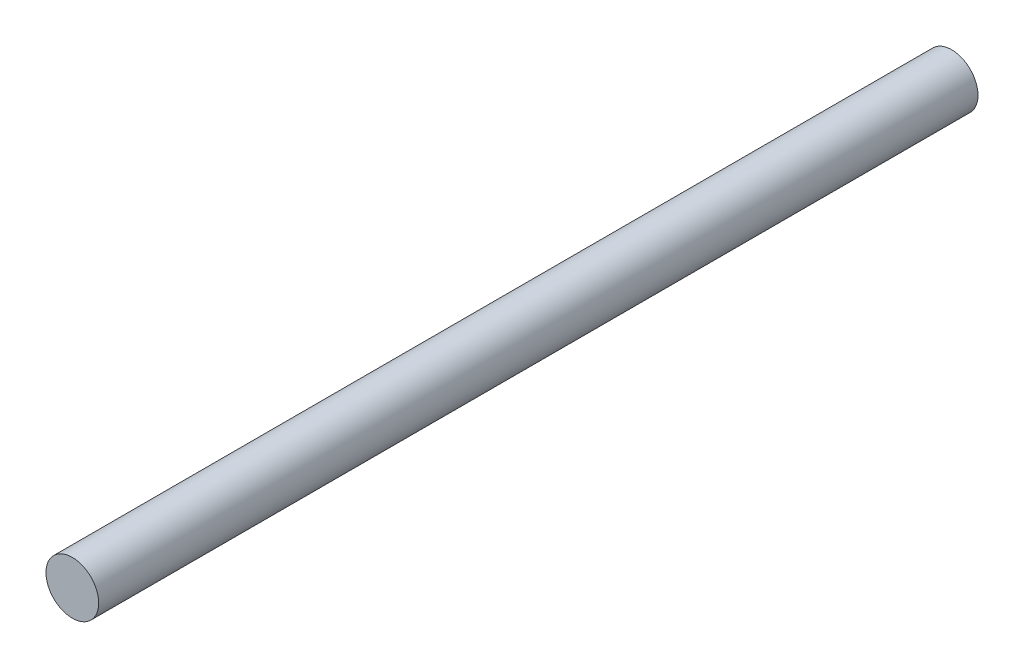
from build123d import *

# Parameters (mm, degrees)
SKETCH_1_R      = 6
EXTRUDE_1_DEPTH = 200


with BuildPart() as part:
    # 草图1 → 凸台-拉伸1 (new body)
    with BuildSketch(Plane.XY):
        Circle(SKETCH_1_R)
    extrude(amount=EXTRUDE_1_DEPTH)


solid = part.part
